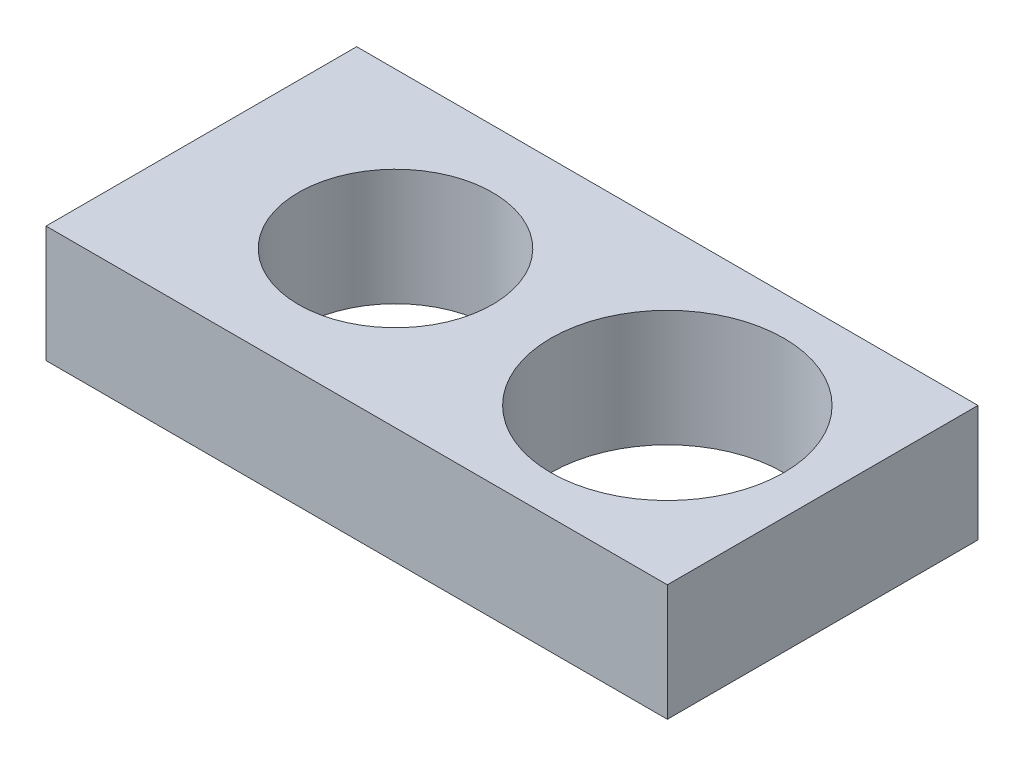
from build123d import *

# Parameters (mm, degrees)
SKETCH2_W           = 80
SKETCH2_H           = 40
SKETCH2_R           = 12.5
SKETCH2_R_2         = 15
BOSS_EXTRUDE1_DEPTH = 15


with BuildPart() as part:
    # Sketch2 → Boss-Extrude1 (new body)
    with BuildSketch(Plane(origin=(0, 0, 0), x_dir=(1, 0, 0), z_dir=(0, 1, 0))):
        Rectangle(SKETCH2_W, SKETCH2_H)
        with Locations(Location((-15, 0, 0), (0, 0, 270))):
            Circle(SKETCH2_R, mode=Mode.SUBTRACT)
        with Locations(Location((20, 0, 0), (0, 0, 270))):
            Circle(SKETCH2_R_2, mode=Mode.SUBTRACT)
    extrude(amount=BOSS_EXTRUDE1_DEPTH)


solid = part.part
